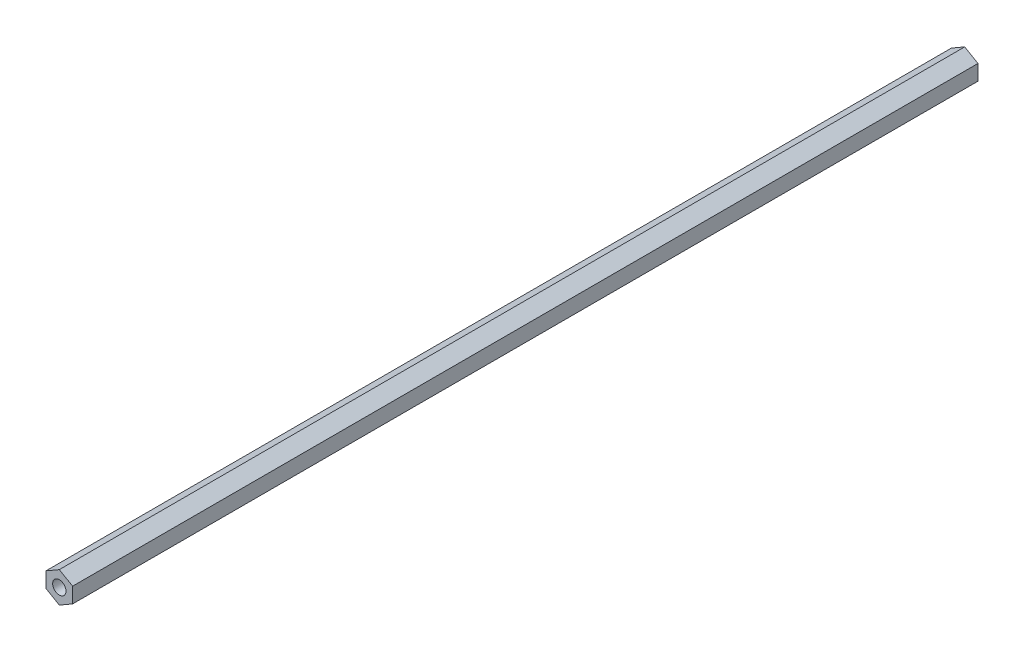
from build123d import *

# Parameters (mm, degrees)
BOSS_EXTRUDE2_DEPTH             = 216.026999
BOSS_EXTRUDE2_DEPTH_BACK        = 216.026999
F_1_4_0_25_DIAMETER_HOLE1_D     = 6.35
F_1_4_0_25_DIAMETER_HOLE1_DEPTH = 25.4
F_1_4_0_25_DIAMETER_HOLE1_TIP   = 1.907732465
F_1_4_0_25_DIAMETER_HOLE2_D     = 6.35
F_1_4_0_25_DIAMETER_HOLE2_DEPTH = 25.4
F_1_4_0_25_DIAMETER_HOLE2_TIP   = 1.907732465


with BuildPart() as part:
    # Sketch3 → Boss-Extrude2 (new, two sides: drawn at the far end of the back side and taken through both)
    with BuildSketch(Plane.XY.offset(-BOSS_EXTRUDE2_DEPTH_BACK)):
        Polygon((-6.35, -3.666174209), (0, -7.332348419), (6.35, -3.666174209), (6.35, 3.666174209), (0, 7.332348419), (-6.35, 3.666174209), align=None)
    extrude(amount=BOSS_EXTRUDE2_DEPTH + BOSS_EXTRUDE2_DEPTH_BACK)

    # 1/4 (0.25) Diameter Hole1
    with Locations(Plane.XY.offset(216.026998984)):
        with Locations((0, 0)):
            Hole(F_1_4_0_25_DIAMETER_HOLE1_D / 2, depth=F_1_4_0_25_DIAMETER_HOLE1_DEPTH)
            with Locations((0, 0, -(F_1_4_0_25_DIAMETER_HOLE1_DEPTH + F_1_4_0_25_DIAMETER_HOLE1_TIP / 2))):  # 118° drill point
                Cone(0, F_1_4_0_25_DIAMETER_HOLE1_D / 2, F_1_4_0_25_DIAMETER_HOLE1_TIP, mode=Mode.SUBTRACT)

    # 1/4 (0.25) Diameter Hole2
    with Locations(Plane(origin=(0, 0, -216.026998984), x_dir=(-1, 0, 0), z_dir=(0, 0, -1))):
        with Locations((0, 0)):
            Hole(F_1_4_0_25_DIAMETER_HOLE2_D / 2, depth=F_1_4_0_25_DIAMETER_HOLE2_DEPTH)
            with Locations((0, 0, -(F_1_4_0_25_DIAMETER_HOLE2_DEPTH + F_1_4_0_25_DIAMETER_HOLE2_TIP / 2))):  # 118° drill point
                Cone(0, F_1_4_0_25_DIAMETER_HOLE2_D / 2, F_1_4_0_25_DIAMETER_HOLE2_TIP, mode=Mode.SUBTRACT)


solid = part.part
